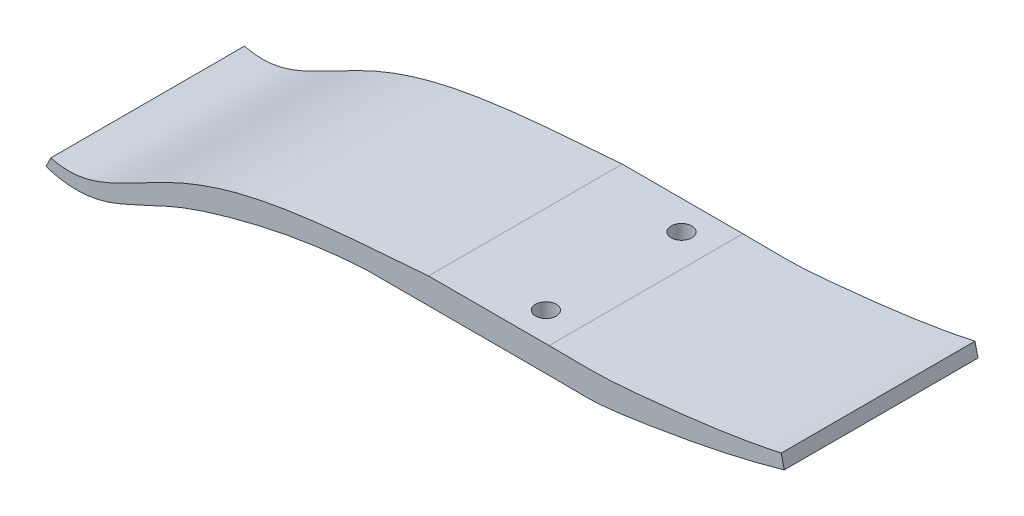
from build123d import *

# Parameters (mm, degrees)
ESTRUSIONE_ESTRUSIONE1_DEPTH = 60
SCHIZZO2_R                   = 3.2
TAGLIO_ESTRUSIONE1_DEPTH     = 233.889820397


with BuildPart() as part:
    # Schizzo1 → Estrusione-Estrusione1 (new body)
    with BuildSketch(Plane.XY):
        with BuildLine():
            Line((150, 0), (112.652759777, 0))
            add(Edge.make_bspline(
                [(112.652759777, 0), (98.237662575, -1.178240864), (76.325416845, -2.367087178), (50.386085211, -7.715299834), (33.034853179, -14.26020997), (17.005808568, -23.385929695), (4.046336606, -28.877814003), (-3.966333357, -26.937004661)],
                knots=[0, 0, 0, 0, 0.357718306, 0.541412235, 0.651991695, 0.814467727, 0.997098774, 0.997098774, 0.997098774, 0.997098774], degree=3))
            add(Edge.make_bspline(
                [(-3.966333357, -26.937004661), (-4.093620386, -26.906173508), (-4.221198761, -26.874119155), (-4.34907219, -26.840823763)],
                knots=[0.997098774, 0.997098774, 0.997098774, 0.997098774, 1, 1, 1, 1], degree=3))
            Line((-4.34907219, -26.840823763), (-5.819646619, -29.843392582))
            add(Edge.make_bspline(
                [(93.176931163, -8), (78.095796931, -8.806994611), (58.515182539, -12.465092597), (33.425903267, -20.492787938), (21.868566108, -26.59175254), (8.46872535, -31.84989808), (-0.020847935, -31.917998972), (-5.819646619, -29.843392582)],
                knots=[0, 0, 0, 0, 0.439768474, 0.579665595, 0.767580002, 0.820026739, 1, 1, 1, 1], degree=3))
            Line((93.176931163, -8), (150, -8))
            add(Edge.make_bspline(
                [(150, -8), (160.934675431, -8.178500572), (167.732636416, -7.981403235), (191.218183044, -4.400657167), (208.863871924, -0.957960193), (222.824656402, 3.062271003)],
                knots=[0, 0, 0, 0, 0.132806244, 0.367168858, 1, 1, 1, 1], degree=3))
            Line((222.824656402, 3.062271003), (221.895107654, 7.130147587))
            add(Edge.make_bspline(
                [(150, 0), (155.186432149, -0.071874262), (162.776030143, -0.192676418), (171.94252973, 0.198053168), (191.054206551, 2.042329396), (208.370998681, 4.160926661), (221.895107654, 7.130147587)],
                knots=[0, 0, 0, 0, 0.180513483, 0.221559148, 0.410456652, 1, 1, 1, 1], degree=3))
        make_face()
    extrude(amount=-ESTRUSIONE_ESTRUSIONE1_DEPTH)

    # Schizzo2 → Taglio-Estrusione1 (cut, through all)
    with BuildSketch(Plane(origin=(0, 0, 0), x_dir=(1, 0, 0), z_dir=(0, 1, 0))):
        with Locations(Location((140, 51, 0), (0, 0, 270))):
            Circle(SCHIZZO2_R)
        with Locations(Location((140, 9, 0), (0, 0, 90))):
            Circle(SCHIZZO2_R)
    extrude(amount=-TAGLIO_ESTRUSIONE1_DEPTH, mode=Mode.SUBTRACT)


solid = part.part
